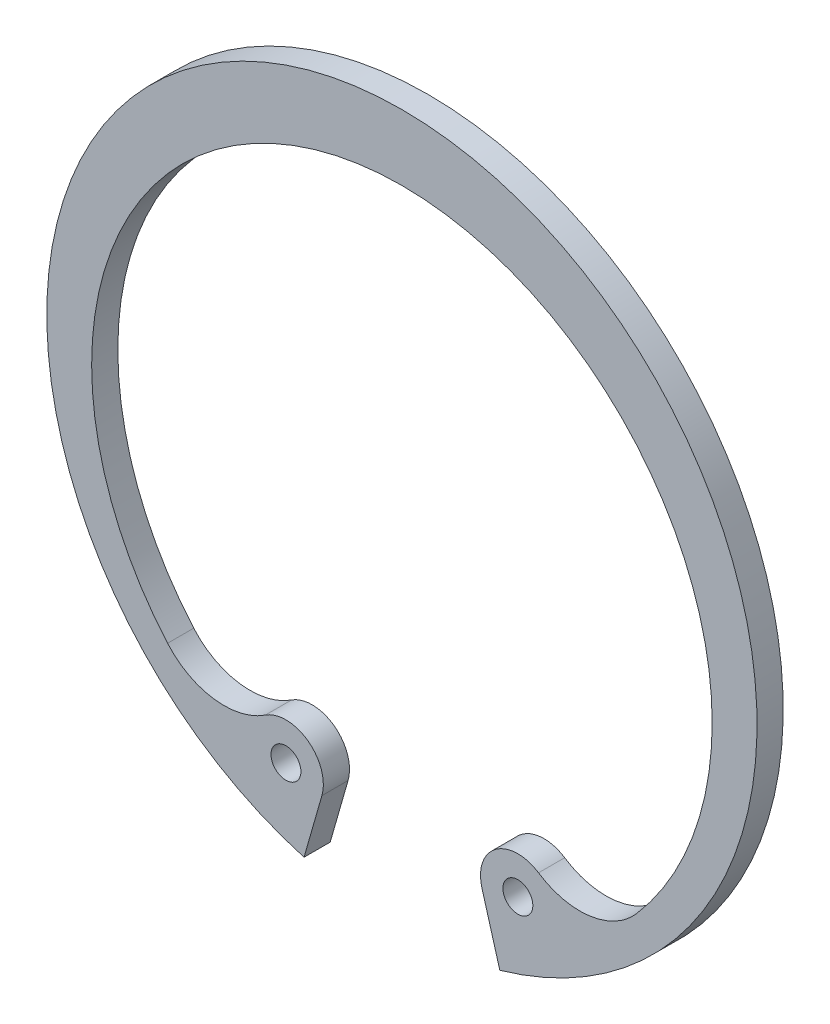
from build123d import *

# Parameters (mm, degrees)
SKETCH2_R           = 1
BOSS_EXTRUDE1_DEPTH = 1.75


with BuildPart() as part:
    # Sketch2 → Boss-Extrude1 (new body)
    with BuildSketch(Plane.XY):
        with BuildLine():
            ThreePointArc((-5.351990622, -18.664609398), (-6.277079647, -15.959251249), (-9.135419395, -15.891087439))
            ThreePointArc((-9.135419395, -15.891087439), (-12.571938491, -16.676326013), (-15.672466243, -14.999128717))
            ThreePointArc((-15.672466243, -14.999128717), (3.5e-08, 19.35), (15.672466197, -14.99912877))
            ThreePointArc((15.672466197, -14.99912877), (12.571938449, -16.676326019), (9.135419383, -15.891087431))
            ThreePointArc((9.135419383, -15.891087431), (6.277079669, -15.959251233), (5.351990603, -18.664609332))
            Line((5.351990603, -18.664609332), (6.546387201, -22.829965279))
            ThreePointArc((6.546387201, -22.829965279), (0, 23.75), (-6.546387201, -22.829965279))
            Line((-6.546387201, -22.829965279), (-5.351990622, -18.664609398))
        make_face()
        with Locations((-7.755144841, -17.975515935)):
            Circle(SKETCH2_R, mode=Mode.SUBTRACT)
        with Locations((7.755144841, -17.975515935)):
            Circle(SKETCH2_R, mode=Mode.SUBTRACT)
    extrude(amount=BOSS_EXTRUDE1_DEPTH)


solid = part.part
